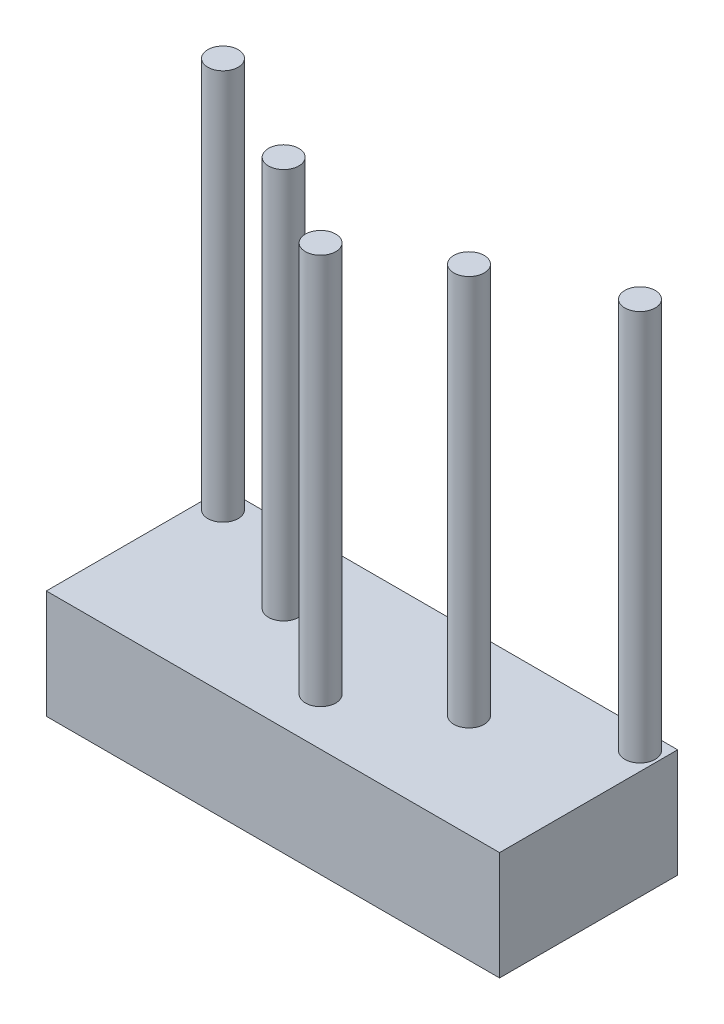
from build123d import *

# Parameters (mm, degrees)
SKETCH1_W           = 79.502
SKETCH1_H           = 31.242
BOSS_EXTRUDE1_DEPTH = 19.05
SKETCH2_R           = 2.667
BOSS_EXTRUDE2_DEPTH = 68.58


with BuildPart() as part:
    # Sketch1 → Boss-Extrude1 (new body)
    with BuildSketch(Plane(origin=(0, 0, 0), x_dir=(1, 0, 0), z_dir=(0, 1, 0))):
        Rectangle(SKETCH1_W, SKETCH1_H)
    extrude(amount=BOSS_EXTRUDE1_DEPTH)

    # Sketch2 → Boss-Extrude2 (add)
    with BuildSketch(Plane(origin=(0, 19.05, 0), x_dir=(1, 0, 0), z_dir=(0, 1, 0))):
        with Locations(Location((-36.576, 12.192, 0), (0, 0, 270))):
            Circle(SKETCH2_R)
        with Locations(Location((-16.256, 2.515131479, 0), (0, 0, 270))):
            Circle(SKETCH2_R)
        with Locations(Location((0, -7.263868521, 0), (0, 0, 270))):
            Circle(SKETCH2_R)
        with Locations(Location((16.256, 2.515131479, 0), (0, 0, 270))):
            Circle(SKETCH2_R)
        with Locations(Location((36.576, 12.192, 0), (0, 0, 270))):
            Circle(SKETCH2_R)
    extrude(amount=BOSS_EXTRUDE2_DEPTH)


solid = part.part
